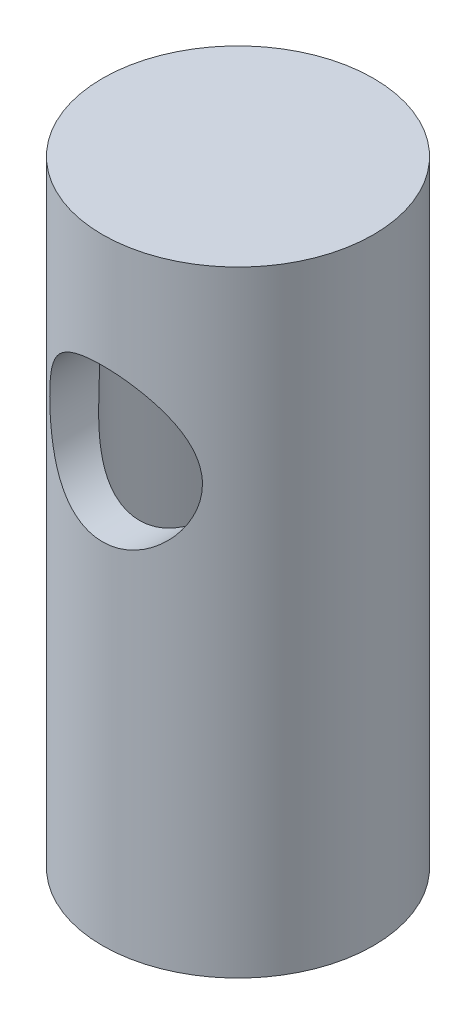
from build123d import *

# Parameters (mm, degrees)
SKETCH_1_W               = 5.5
SKETCH_1_H               = 25
CUT_EXTRUDE_1_DEPTH      = 27.182054923
CUT_EXTRUDE_1_DEPTH_BACK = 27.182054923
SKETCH_3_R               = 3.1
SKETCH_4_R               = 4
CUT_EXTRUDE_2_DEPTH      = 24


with BuildPart() as part:
    # 草图1 → 旋转1 (revolve)
    with BuildSketch(Plane.XY, mode=Mode.PRIVATE) as revolve_1_sk:
        with Locations((2.75, 12.5)):
            Rectangle(SKETCH_1_W, SKETCH_1_H)
    revolve(revolve_1_sk.sketch.rotate(Axis((0, 25, 0), (0, 1, 0)), 180), axis=Axis((0, 25, 0), (0, 1, 0)))

    # 草图3 → 切除-拉伸1 (cut, two sides: drawn at the far end of the back side and taken through both)
    with BuildSketch(Plane.XY.offset(-CUT_EXTRUDE_1_DEPTH_BACK)):
        with Locations((0, 17.3)):
            Circle(SKETCH_3_R)
    extrude(amount=CUT_EXTRUDE_1_DEPTH + CUT_EXTRUDE_1_DEPTH_BACK, mode=Mode.SUBTRACT)

    # 草图4 → 切除-拉伸2 (cut)
    with BuildSketch(Plane.XZ):
        Circle(SKETCH_4_R)
    extrude(amount=-CUT_EXTRUDE_2_DEPTH, mode=Mode.SUBTRACT)


solid = part.part
